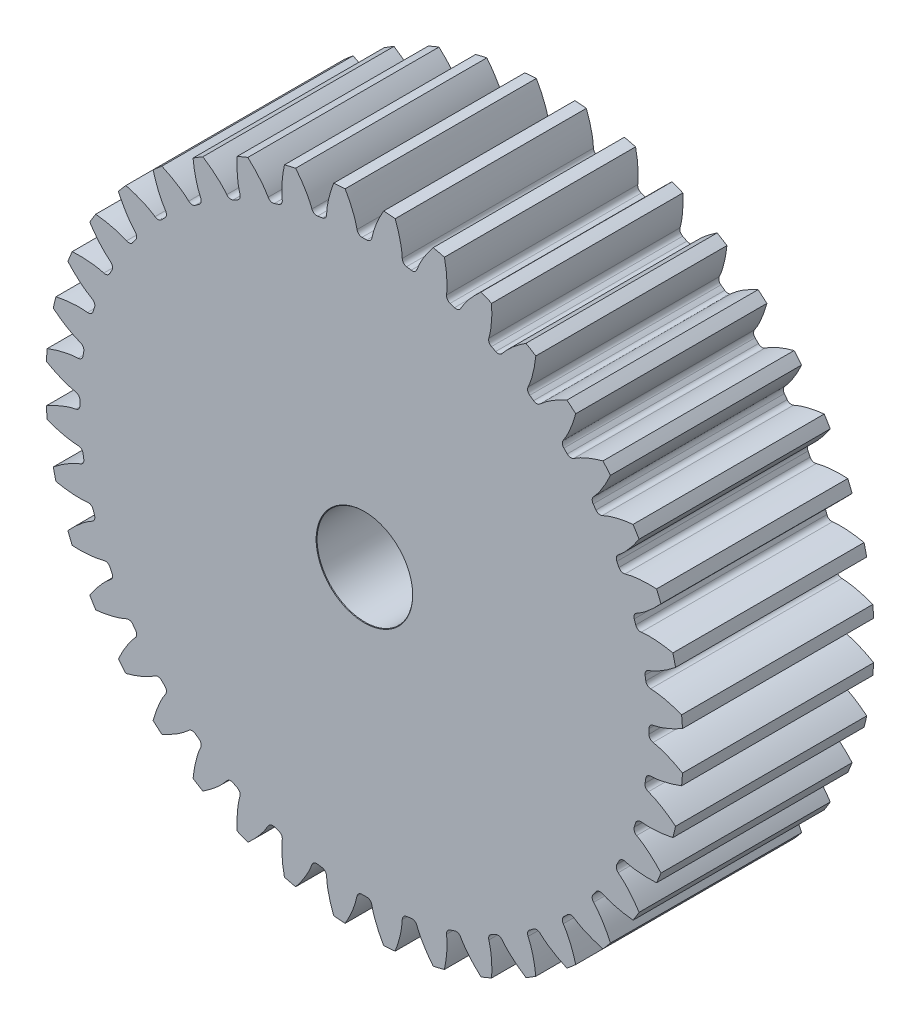
from build123d import *

# Parameters (mm, degrees)
BOSS_EXTRUDE1_DEPTH             = 5
BOSS_EXTRUDE1_DEPTH_BACK        = 5
SKETCH3_R                       = 16.66875
CUT_EXTRUDE1_DEPTH              = 25.097602643
FILLET1_R                       = 0.266307122
CIRPATTERN1_COUNT               = 40
FILLET1_OF_CIRPATTERN1_R        = 0.266307122
F_5_0MM_DOWEL_HOLE1_D           = 5
F_5_0MM_DOWEL_HOLE1_CSINK_D     = 5.05
F_5_0MM_DOWEL_HOLE1_CSINK_ANGLE = 90


with BuildPart() as part:
    # Sketch3 → Boss-Extrude1 (new, two sides: drawn at the far end of the back side and taken through both)
    with BuildSketch(Plane.XY.offset(-BOSS_EXTRUDE1_DEPTH_BACK)):
        Circle(SKETCH3_R)
    extrude(amount=BOSS_EXTRUDE1_DEPTH + BOSS_EXTRUDE1_DEPTH_BACK)

    # Sketch4 → Cut-Extrude1 (cut, symmetric)
    with BuildSketch(Plane.XY):
        with BuildLine():
            Line((14.878394914, 0.36259165), (14.913192437, 0.363439678))
            add(Edge.make_bspline(
                [(14.913192437, 0.363439678), (14.915932121, 0.363535365), (14.923613754, 0.363893266), (14.938125953, 0.364923437), (14.961789134, 0.367106592), (14.9919122, 0.370626534), (15.030810507, 0.376023905), (15.076581712, 0.383472603), (15.12682317, 0.392801052), (15.181412661, 0.404183189), (15.235805402, 0.416628993), (15.28999624, 0.43005936), (15.343913358, 0.444353581), (15.409141175, 0.462750391), (15.487236161, 0.486313697), (15.578328649, 0.51604657), (15.681407364, 0.552353468), (15.786194232, 0.592121026), (15.889077748, 0.633523786), (15.992749608, 0.677967317), (16.09285943, 0.722818906), (16.196538779, 0.772080887), (16.292085972, 0.818912247), (16.398778373, 0.874340048), (16.484777514, 0.919934703), (16.573306231, 0.969501611), (16.616347812, 0.993990285), (16.638325167, 1.006658928)],
                knots=[0, 0, 0, 0, 0, 0.005376749, 0.015083688, 0.02853182, 0.04661014, 0.064854849, 0.092110526, 0.119476176, 0.146842496, 0.174208854, 0.201574956, 0.228941013, 0.256307345, 0.307035032, 0.361767352, 0.416499661, 0.471231937, 0.525964282, 0.580696616, 0.635428982, 0.690161387, 0.744893688, 0.799626082, 0.854358407, 0.909090914, 0.909090914, 0.909090914, 0.909090914, 0.909090914], degree=4))
            ThreePointArc((16.638325167, 1.006658928), (16.66875, 0), (16.638325167, -1.006658928))
            add(Edge.make_bspline(
                [(14.913192437, -0.363439678), (14.915932121, -0.363535365), (14.923613754, -0.363893266), (14.938125953, -0.364923437), (14.961789134, -0.367106592), (14.9919122, -0.370626534), (15.030810507, -0.376023905), (15.076581712, -0.383472603), (15.12682317, -0.392801052), (15.181412661, -0.404183189), (15.235805402, -0.416628993), (15.28999624, -0.43005936), (15.343913358, -0.444353581), (15.409141175, -0.462750391), (15.487236161, -0.486313697), (15.578328649, -0.51604657), (15.681407364, -0.552353468), (15.786194232, -0.592121026), (15.889077748, -0.633523786), (15.992749608, -0.677967317), (16.09285943, -0.722818906), (16.196538779, -0.772080887), (16.292085972, -0.818912247), (16.398778373, -0.874340048), (16.484777514, -0.919934703), (16.573306231, -0.969501611), (16.616347812, -0.993990285), (16.638325167, -1.006658928)],
                knots=[0, 0, 0, 0, 0, 0.005376749, 0.015083688, 0.02853182, 0.04661014, 0.064854849, 0.092110526, 0.119476176, 0.146842496, 0.174208854, 0.201574956, 0.228941013, 0.256307345, 0.307035032, 0.361767352, 0.416499661, 0.471231937, 0.525964282, 0.580696616, 0.635428982, 0.690161387, 0.744893688, 0.799626082, 0.854358407, 0.909090914, 0.909090914, 0.909090914, 0.909090914, 0.909090914], degree=4))
            Line((14.913192437, -0.363439678), (14.878394914, -0.36259165))
            ThreePointArc((14.878394914, -0.36259165), (14.8828125, 0), (14.878394914, 0.36259165))
        make_face()
    cut_extrude1 = extrude(amount=CUT_EXTRUDE1_DEPTH, both=True, mode=Mode.SUBTRACT)

    # Fillet1
    fillet1_edges = [part.edges().sort_by_distance(p)[0] for p in [
        (14.878394914, -0.36259165, 0),
        (14.878394914, 0.36259165, 0),
    ]]
    fillet(fillet1_edges, radius=FILLET1_R)

    # CirPattern1: Cut-Extrude1 ×40 about axis
    cirpattern1_axis = Axis((0, 0, 5.000000033), (0, 0, -1))
    for i in range(1, CIRPATTERN1_COUNT):
        add(cut_extrude1.rotate(cirpattern1_axis, i * 360 / CIRPATTERN1_COUNT), mode=Mode.SUBTRACT)

    # Fillet1 of CirPattern1
    fillet1_of_cirpattern1_edges = [part.edges().sort_by_distance(p)[0] for p in [
        (14.638495352, -2.685621294, 0),
        (14.751939014, -1.969366204, 0),
        (14.038147453, -4.942522029, 0),
        (14.262241416, -4.252831726, 0),
        (13.092133773, -7.077721468, 0),
        (13.421360102, -6.431578416, 0),
        (11.82374831, -9.038643915, 0),
        (12.250000359, -8.451958301, 0),
        (10.264222922, -10.777004951, 0),
        (10.777004951, -10.264222922, 0),
        (8.451958301, -12.250000359, 0),
        (9.038643915, -11.82374831, 0),
        (6.431578416, -13.421360102, 0),
        (7.077721468, -13.092133773, 0),
        (4.252831726, -14.262241416, 0),
        (4.942522029, -14.038147453, 0),
        (1.969366204, -14.751939014, 0),
        (2.685621294, -14.638495352, 0),
        (-0.36259165, -14.878394914, 0),
        (0.36259165, -14.878394914, 0),
        (-2.685621294, -14.638495352, 0),
        (-1.969366204, -14.751939014, 0),
        (-4.942522029, -14.038147453, 0),
        (-4.252831726, -14.262241416, 0),
        (-7.077721468, -13.092133773, 0),
        (-6.431578416, -13.421360102, 0),
        (-9.038643915, -11.82374831, 0),
        (-8.451958301, -12.250000359, 0),
        (-10.777004951, -10.264222922, 0),
        (-10.264222922, -10.777004951, 0),
        (-12.250000359, -8.451958301, 0),
        (-11.82374831, -9.038643915, 0),
        (-13.421360102, -6.431578416, 0),
        (-13.092133773, -7.077721468, 0),
        (-14.262241416, -4.252831726, 0),
        (-14.038147453, -4.942522029, 0),
        (-14.751939014, -1.969366204, 0),
        (-14.638495352, -2.685621294, 0),
        (-14.878394914, 0.36259165, 0),
        (-14.878394914, -0.36259165, 0),
        (-14.638495352, 2.685621294, 0),
        (-14.751939014, 1.969366204, 0),
        (-14.038147453, 4.942522029, 0),
        (-14.262241416, 4.252831726, 0),
        (-13.092133773, 7.077721468, 0),
        (-13.421360102, 6.431578416, 0),
        (-11.82374831, 9.038643915, 0),
        (-12.250000359, 8.451958301, 0),
        (-10.264222922, 10.777004951, 0),
        (-10.777004951, 10.264222922, 0),
        (-8.451958301, 12.250000359, 0),
        (-9.038643915, 11.82374831, 0),
        (-6.431578416, 13.421360102, 0),
        (-7.077721468, 13.092133773, 0),
        (-4.252831726, 14.262241416, 0),
        (-4.942522029, 14.038147453, 0),
        (-1.969366204, 14.751939014, 0),
        (-2.685621294, 14.638495352, 0),
        (0.36259165, 14.878394914, 0),
        (-0.36259165, 14.878394914, 0),
        (2.685621294, 14.638495352, 0),
        (1.969366204, 14.751939014, 0),
        (4.942522029, 14.038147453, 0),
        (4.252831726, 14.262241416, 0),
        (7.077721468, 13.092133773, 0),
        (6.431578416, 13.421360102, 0),
        (9.038643915, 11.82374831, 0),
        (8.451958301, 12.250000359, 0),
        (10.777004951, 10.264222922, 0),
        (10.264222922, 10.777004951, 0),
        (12.250000359, 8.451958301, 0),
        (11.82374831, 9.038643915, 0),
        (13.421360102, 6.431578416, 0),
        (13.092133773, 7.077721468, 0),
        (14.262241416, 4.252831726, 0),
        (14.038147453, 4.942522029, 0),
        (14.751939014, 1.969366204, 0),
        (14.638495352, 2.685621294, 0),
    ]]
    fillet(fillet1_of_cirpattern1_edges, radius=FILLET1_OF_CIRPATTERN1_R)

    # Ø5.0mm Dowel Hole1 (through all)
    with Locations(Plane.XY.offset(5.000000033)):
        with Locations((0, 0)):
            CounterSinkHole(F_5_0MM_DOWEL_HOLE1_D / 2, F_5_0MM_DOWEL_HOLE1_CSINK_D / 2, counter_sink_angle=F_5_0MM_DOWEL_HOLE1_CSINK_ANGLE)


solid = part.part
